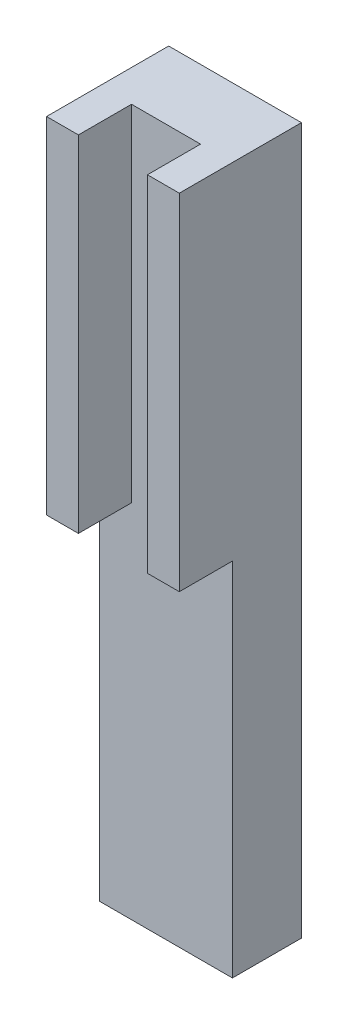
from build123d import *

# Parameters (mm, degrees)
SKETCH1_W           = 25.00122
SKETCH1_H           = 132.99948
BOSS_EXTRUDE1_DEPTH = 22.9997
SKETCH2_W           = 25.00122
SKETCH2_H           = 68.00088
CUT_EXTRUDE1_DEPTH  = 9.99998
SKETCH3_W           = 13.00226
SKETCH3_H           = 64.9986
CUT_EXTRUDE2_DEPTH  = 9.99998


with BuildPart() as part:
    # Sketch1 → Boss-Extrude1 (new body)
    with BuildSketch(Plane.XY):
        with Locations((12.50061, 66.49974)):
            Rectangle(SKETCH1_W, SKETCH1_H)
    extrude(amount=BOSS_EXTRUDE1_DEPTH)

    # Sketch2 → Cut-Extrude1 (cut)
    with BuildSketch(Plane.XY.offset(22.9997)):
        with Locations((12.50061, 34.00044)):
            Rectangle(SKETCH2_W, SKETCH2_H)
    extrude(amount=-CUT_EXTRUDE1_DEPTH, mode=Mode.SUBTRACT)

    # Sketch3 → Cut-Extrude2 (cut)
    with BuildSketch(Plane.XY.offset(22.9997)):
        with Locations((12.50061, 100.50018)):
            Rectangle(SKETCH3_W, SKETCH3_H)
    extrude(amount=-CUT_EXTRUDE2_DEPTH, mode=Mode.SUBTRACT)


solid = part.part
